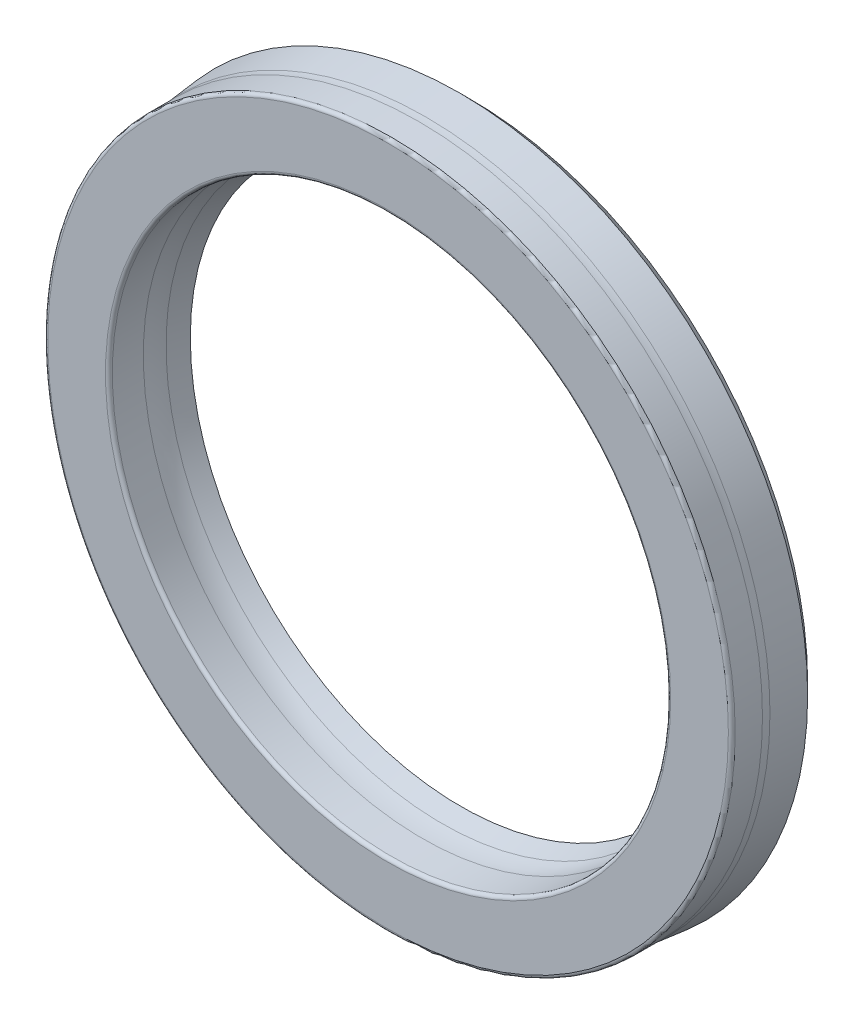
from build123d import *


with BuildPart() as part:
    # Sketch1 → Revolve1 (revolve)
    with BuildSketch(Plane(origin=(0, 0, 0), x_dir=(0, 0, -1), z_dir=(1, 0, 0))):
        with BuildLine():
            Line((0, 41.25), (0, 49.675))
            ThreePointArc((0, 49.675), (0.146446609, 50.028553391), (0.5, 50.175))
            Line((0.5, 50.175), (4.478693294, 50.175))
            ThreePointArc((4.478693294, 50.175), (4.999293087, 50.188560401), (5.518480971, 50.229204829))
            Line((5.518480971, 50.229204829), (10.5, 50.75))
            Line((10.5, 50.75), (12, 49.25))
            Line((12, 49.25), (12, 47.5))
            Line((12, 47.5), (7.711429508, 46.207458652))
            ThreePointArc((7.711429508, 46.207458652), (7.000073654, 45.237863155), (7.734753866, 44.285819266))
            Line((7.734753866, 44.285819266), (11.5, 43.25))
            Line((11.5, 43.25), (11.5, 41))
            Line((11.5, 41), (10.633974596, 39.5))
            Line((10.633974596, 39.5), (7.915505944, 40.321990009))
            ThreePointArc((7.915505944, 40.321990009), (6.484090894, 40.642418817), (5.021199936, 40.75))
            Line((5.021199936, 40.75), (0.5, 40.75))
            ThreePointArc((0.5, 40.75), (0.146446609, 40.896446609), (0, 41.25))
        make_face()
    revolve(axis=Axis((0, 0, 0), (0, 0, -1)))


solid = part.part
